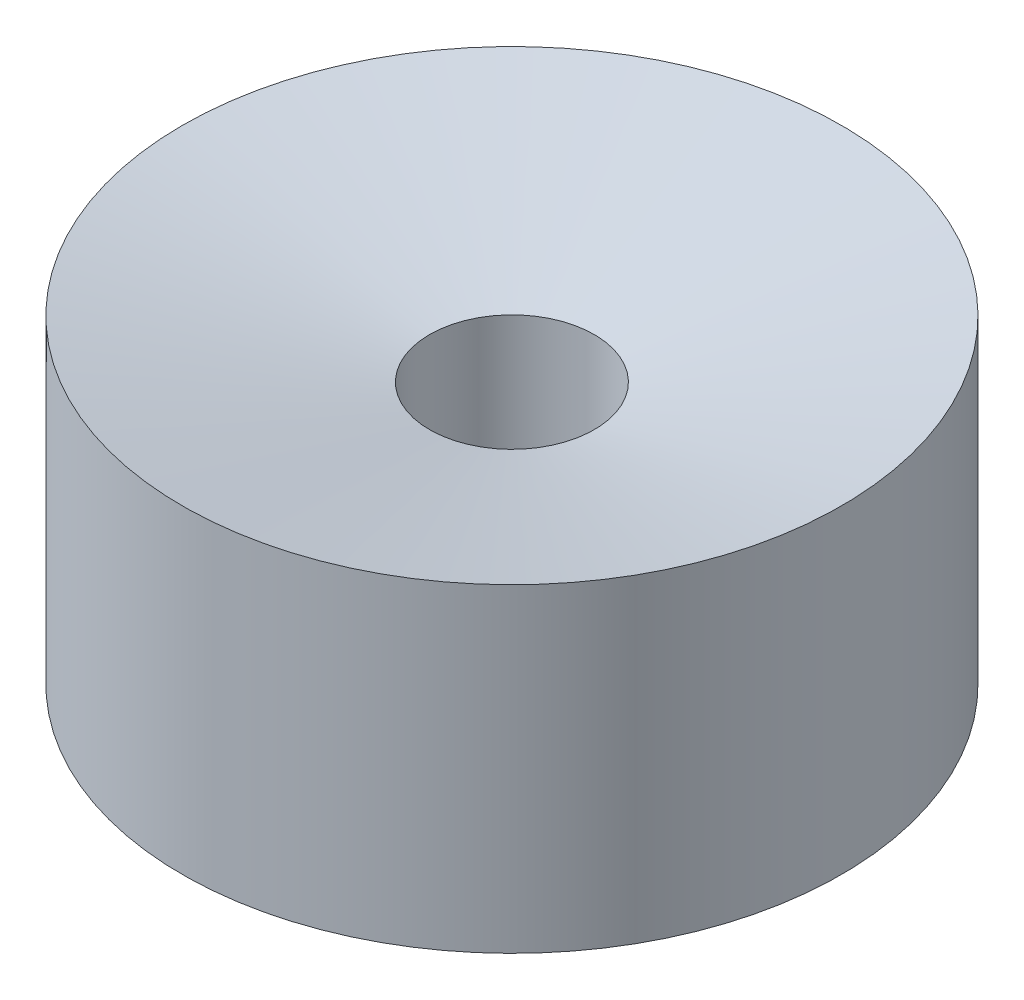
from build123d import *

# Parameters (mm, degrees)
CUT_EXTRUDE_1_REACH = 4.503
SKETCH_2_R          = 0.275


with BuildPart() as part:
    # 草图1 → 旋转1 (revolve)
    with BuildSketch(Plane.XY, mode=Mode.PRIVATE) as revolve_1_sk:
        Polygon((0, 0), (0.7, 0), (0.7, 0.819692267), (1.14, 0.819692267), (1.28, 0.819692267), (1.28, 0.519692267), (1.14, 0.519692267), (1.14, -0.33), (1.6, -0.33), (1.6, 1.22), (0.4, 0.94056338), (0.4, 0.15), (0, 0.15), align=None)
    revolve(revolve_1_sk.sketch.rotate(Axis((0, 0.15, 0), (0, -1, 0)), 180), axis=Axis((0, 0.15, 0), (0, -1, 0)))

    # 草图2 → 切除-拉伸1 (cut, up to next)
    with BuildSketch(Plane(origin=(0, 0.15, 0), x_dir=(1, 0, 0), z_dir=(0, 1, 0)), mode=Mode.PRIVATE) as cut_extrude_1_sk1:
        with Locations(Location((0, 0, 0), (0, 0, 180))):
            Circle(SKETCH_2_R)
    cut_extrude_1_tool1 = extrude(cut_extrude_1_sk1.sketch, amount=-CUT_EXTRUDE_1_REACH, mode=Mode.PRIVATE) & part.part
    add(cut_extrude_1_tool1.solids().sort_by_distance((0, 0.15, 0))[0], mode=Mode.SUBTRACT)


solid = part.part
